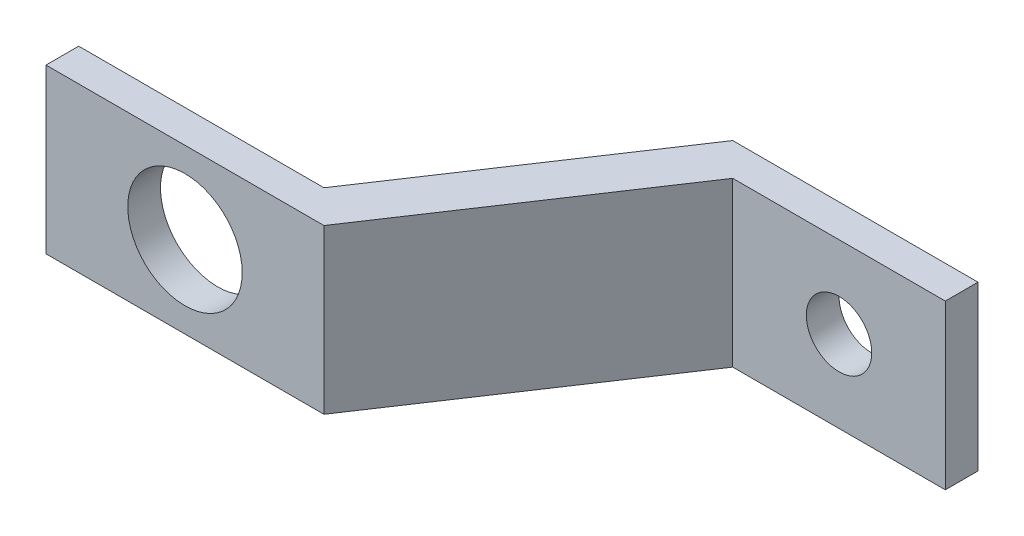
from build123d import *

# Parameters (mm, degrees)
BOSS_EXTRUDE1_DEPTH = 10
SKETCH3_R           = 3.5
SKETCH3_R_2         = 2
CUT_EXTRUDE1_DEPTH  = 30


with BuildPart() as part:
    # Sketch2 → Boss-Extrude1 (new body)
    with BuildSketch(Plane(origin=(0, 0, 0), x_dir=(1, 0, 0), z_dir=(0, 1, 0))):
        Polygon((0, 0), (15, 0), (25, 15), (40, 15), (40, 13), (27, 13), (17, -2), (0, -2), align=None)
    extrude(amount=BOSS_EXTRUDE1_DEPTH)

    # Sketch3 → Cut-Extrude1 (cut)
    with BuildSketch(Plane.XY.offset(2)):
        with Locations((8.5, 5)):
            Circle(SKETCH3_R)
        with Locations((33.5, 5)):
            Circle(SKETCH3_R_2)
    extrude(amount=-CUT_EXTRUDE1_DEPTH, mode=Mode.SUBTRACT)


solid = part.part
